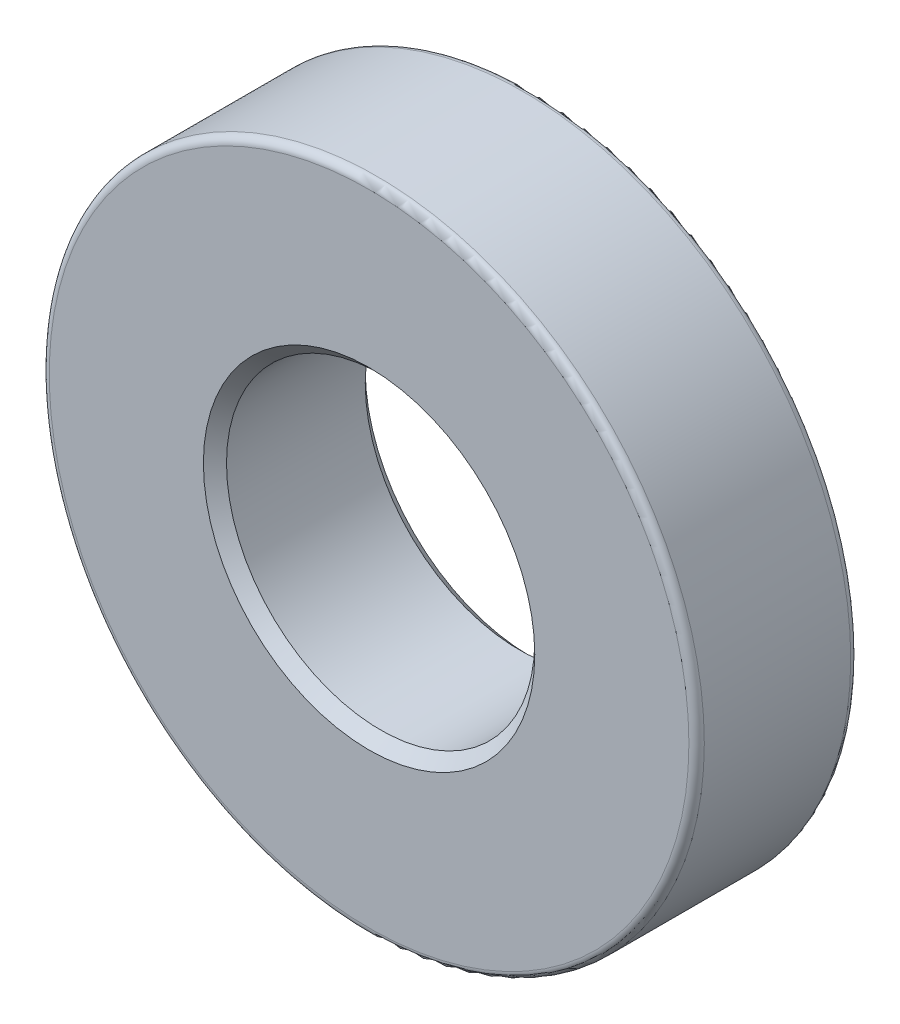
from build123d import *

# Parameters (mm, degrees)
SKETCH1_R           = 8.5
SKETCH1_R_2         = 4
BOSS_EXTRUDE1_DEPTH = 4.2
CHAMFER1_SIZE       = 0.3
FILLET1_R           = 0.2


with BuildPart() as part:
    # Sketch1 → Boss-Extrude1 (new body)
    with BuildSketch(Plane.XY):
        Circle(SKETCH1_R)
        Circle(SKETCH1_R_2, mode=Mode.SUBTRACT)
    extrude(amount=BOSS_EXTRUDE1_DEPTH)

    # Chamfer1
    chamfer1_edges = [part.edges().sort_by_distance(p)[0] for p in [
        (-4, 0, 0),
        (-4, 0, 4.2),
    ]]
    chamfer(chamfer1_edges, length=CHAMFER1_SIZE)

    # Fillet1
    fillet1_edges = [part.edges().sort_by_distance(p)[0] for p in [
        (-8.5, 0, 0),
        (-8.5, 0, 4.2),
    ]]
    fillet(fillet1_edges, radius=FILLET1_R)


solid = part.part
